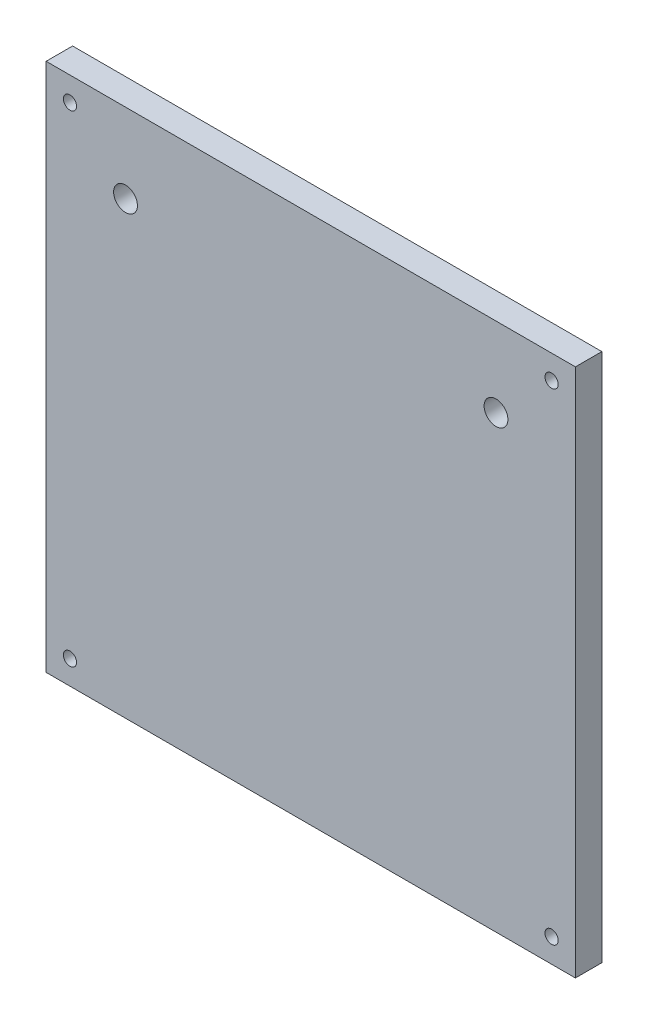
from build123d import *

# Parameters (mm, degrees)
SKETCH1_W           = 100
SKETCH1_H           = 100
SKETCH1_R           = 1.25
SKETCH1_R_2         = 2.25
BOSS_EXTRUDE1_DEPTH = 5


with BuildPart() as part:
    # Sketch1 → Boss-Extrude1 (new body)
    with BuildSketch(Plane.XY):
        Rectangle(SKETCH1_W, SKETCH1_H)
        with Locations((-45.5, 45.5)):
            Circle(SKETCH1_R, mode=Mode.SUBTRACT)
        with Locations((45.5, 45.5)):
            Circle(SKETCH1_R, mode=Mode.SUBTRACT)
        with Locations((45.5, -45.5)):
            Circle(SKETCH1_R, mode=Mode.SUBTRACT)
        with Locations((-45.5, -45.5)):
            Circle(SKETCH1_R, mode=Mode.SUBTRACT)
        with Locations((-35, 35)):
            Circle(SKETCH1_R_2, mode=Mode.SUBTRACT)
        with Locations((35, 35)):
            Circle(SKETCH1_R_2, mode=Mode.SUBTRACT)
    extrude(amount=BOSS_EXTRUDE1_DEPTH)


solid = part.part
